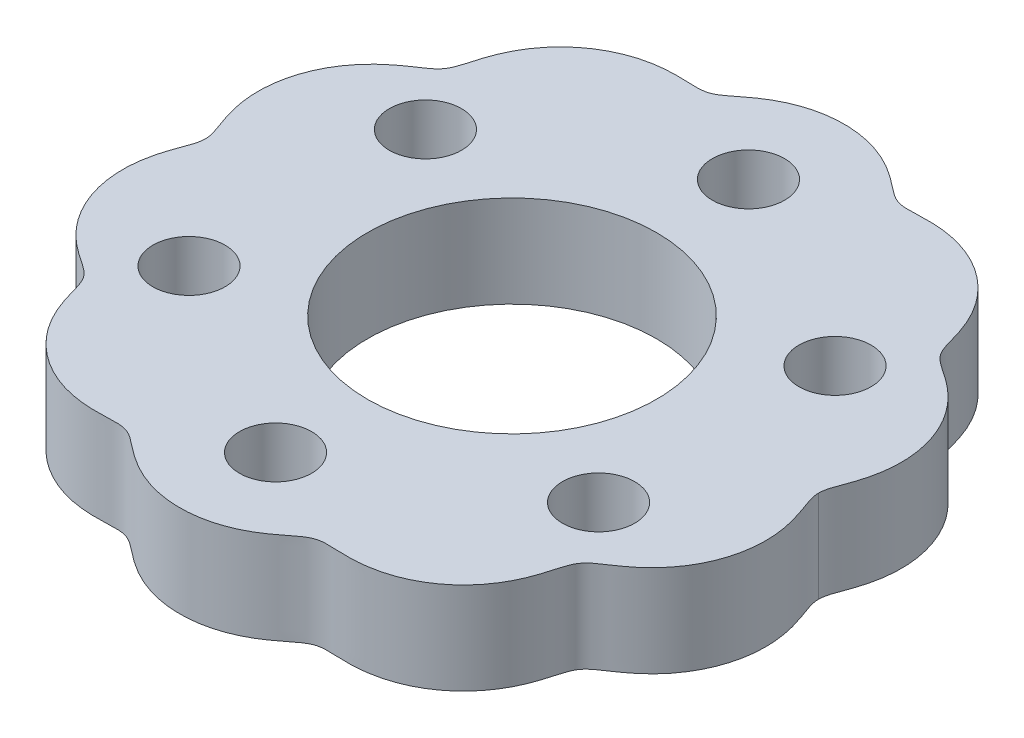
from build123d import *

# Parameters (mm, degrees)
SKETCH1_R           = 11
BOSS_EXTRUDE1_DEPTH = 7
SKETCH2_R           = 2.75
CUT_EXTRUDE1_DEPTH  = 36.882862426


with BuildPart() as part:
    # Sketch1 → Boss-Extrude1 (new body)
    with BuildSketch(Plane(origin=(0, 0, 0), x_dir=(1, 0, 0), z_dir=(0, 1, 0))):
        with BuildLine():
            add(Edge.make_bspline(
                [(23.34513946, 0), (23.34513946, -0.019841849), (23.345857024, -0.059526539), (23.349086064, -0.131972669), (23.357556048, -0.232630023), (23.372071983, -0.342829816), (23.394627325, -0.463844292), (23.42679411, -0.602083409), (23.469272032, -0.754115108), (23.518766494, -0.911207547), (23.574301258, -1.074038595), (23.650463686, -1.286648292), (23.747403521, -1.548939367), (23.859330357, -1.855388562), (24.010775252, -2.296239437), (24.172307839, -2.831938769), (24.322680796, -3.467630655), (24.43509115, -4.205703258), (24.49722378, -5.137006136), (24.443208092, -6.257490487), (24.192031764, -7.544978102), (23.655168641, -8.944366843), (22.885138777, -10.230698218), (21.904732121, -11.364217407), (20.940073548, -12.163449269), (20.10299199, -12.716798247), (19.493333172, -13.128038299), (19.136683847, -13.414056341), (18.845316969, -13.747591241), (18.659306345, -14.090946802), (18.532638856, -14.426757937), (18.408446796, -14.826850067), (18.228407959, -15.481027869), (17.948461455, -16.416013941), (17.439836685, -17.587775117), (16.620670211, -18.84294683), (15.596856575, -19.937990999), (14.399706124, -20.840021851), (13.064682854, -21.521820777), (11.811251526, -21.908028313), (10.703318085, -22.082620055), (9.786396812, -22.129613288), (9.155870124, -22.121246094), (8.626814751, -22.098225929), (8.218064234, -22.08526951), (7.915067374, -22.086238639), (7.605101517, -22.10879134), (7.285997765, -22.167002323), (6.846391649, -22.332062806), (6.360022198, -22.666279074), (5.833479317, -23.093709021), (5.223911343, -23.560790037), (4.604706463, -23.976916548), (3.792237954, -24.43634194), (2.760935396, -24.8773862), (1.493349134, -25.214815983), (1.7353e-05, -25.344645275), (-1.493389976, -25.214809826), (-2.760882247, -24.877400075), (-3.792312658, -24.43631799), (-4.604587047, -23.97695782), (-5.224160138, -23.560702949), (-5.75056756, -23.157070774), (-6.203310659, -22.793749052), (-6.560482534, -22.530303062), (-6.821899181, -22.368719533), (-7.089275116, -22.240696292), (-7.334721546, -22.158314502), (-7.605211336, -22.108620497), (-7.914993021, -22.086350017), (-8.218112322, -22.085198339), (-8.626785765, -22.098268724), (-9.155886973, -22.121221238), (-9.786388709, -22.12962524), (-10.703322745, -22.082613184), (-11.811248592, -21.90803264), (-13.06468466, -21.521818113), (-14.399705093, -20.840023372), (-15.596857207, -19.937990067), (-16.620669798, -18.84294744), (-17.439836994, -17.587774662), (-17.948461244, -16.416014251), (-18.228408078, -15.481027693), (-18.408446741, -14.826850149), (-18.532638885, -14.426757895), (-18.65930633, -14.090946825), (-18.845316978, -13.747591228), (-19.136683842, -13.414056349), (-19.493333175, -13.128038294), (-20.102991988, -12.71679825), (-20.94007355, -12.163449267), (-21.90473212, -11.364217408), (-22.885138778, -10.230698216), (-23.655168641, -8.944366843), (-24.192031764, -7.544978102), (-24.443208092, -6.257490486), (-24.49722378, -5.137006136), (-24.43509115, -4.205703258), (-24.322680796, -3.467630654), (-24.172307839, -2.831938769), (-24.010775253, -2.296239437), (-23.859330357, -1.855388561), (-23.747403521, -1.548939367), (-23.650463686, -1.286648292), (-23.574301258, -1.074038595), (-23.518766494, -0.911207546), (-23.469272032, -0.754115107), (-23.42679411, -0.602083408), (-23.394627325, -0.463844292), (-23.372071983, -0.342829816), (-23.357556048, -0.232630022), (-23.349086064, -0.131972669), (-23.345857024, -0.059526539), (-23.34513946, -0.019841849), (-23.34513946, 0)],
                knots=[0.07419089, 0.07419089, 0.07419089, 0.07419089, 0.07419089, 0.075181354, 0.076171818, 0.077162282, 0.078152746, 0.079827677, 0.081502608, 0.08317754, 0.084852471, 0.08683375, 0.088815028, 0.092777585, 0.096740142, 0.100702699, 0.108628816, 0.116554932, 0.12448019, 0.132405447, 0.148256714, 0.164108108, 0.179959356, 0.195810375, 0.211662134, 0.227513365, 0.23298372, 0.238454075, 0.242930785, 0.246890307, 0.251682833, 0.254933606, 0.258184379, 0.264685924, 0.280537042, 0.296388376, 0.31224015, 0.328091244, 0.34394255, 0.359793511, 0.37564531, 0.383570468, 0.391495626, 0.398790457, 0.402437872, 0.406085287, 0.408877289, 0.411669291, 0.415630359, 0.419842127, 0.428669278, 0.436594793, 0.444520309, 0.452445901, 0.460371494, 0.476222867, 0.492074291, 0.507925709, 0.523777133, 0.539628506, 0.547554099, 0.555479691, 0.563405207, 0.571330722, 0.575744298, 0.580157873, 0.582263757, 0.584369641, 0.588330709, 0.591122711, 0.593914713, 0.597562128, 0.601209543, 0.608504374, 0.616429532, 0.62435469, 0.640206489, 0.65605745, 0.671908756, 0.68775985, 0.703611624, 0.719462958, 0.735314076, 0.741815621, 0.745066394, 0.748317167, 0.753109693, 0.757069215, 0.761545925, 0.76701628, 0.772486635, 0.788337866, 0.804189625, 0.820040644, 0.835891892, 0.851743286, 0.867594553, 0.87551981, 0.883445068, 0.891371184, 0.899297301, 0.903259858, 0.907222415, 0.911184972, 0.91316625, 0.915147529, 0.91682246, 0.918497392, 0.920172323, 0.921847254, 0.922837718, 0.923828182, 0.924818646, 0.92580911, 0.92580911, 0.92580911, 0.92580911, 0.92580911], degree=4))
            add(Edge.make_bspline(
                [(23.34513946, 0), (23.34513946, 0.019841849), (23.345857024, 0.059526539), (23.349086064, 0.131972669), (23.357556048, 0.232630023), (23.372071983, 0.342829816), (23.394627325, 0.463844292), (23.42679411, 0.602083408), (23.469272032, 0.754115108), (23.518766494, 0.911207546), (23.574301258, 1.074038595), (23.650463686, 1.286648292), (23.747403521, 1.548939367), (23.859330357, 1.855388562), (24.010775252, 2.296239437), (24.172307839, 2.831938769), (24.322680796, 3.467630654), (24.43509115, 4.205703258), (24.49722378, 5.137006136), (24.443208092, 6.257490486), (24.192031764, 7.544978102), (23.655168641, 8.944366843), (22.885138777, 10.230698217), (21.904732121, 11.364217407), (20.940073549, 12.163449269), (20.10299199, 12.716798247), (19.493333172, 13.128038299), (19.136683847, 13.414056341), (18.845316969, 13.747591241), (18.659306345, 14.090946802), (18.532638856, 14.426757937), (18.408446796, 14.826850067), (18.228407959, 15.481027868), (17.948461455, 16.416013941), (17.439836685, 17.587775117), (16.620670211, 18.84294683), (15.596856575, 19.937990998), (14.399706124, 20.84002185), (13.064682854, 21.521820776), (11.811251526, 21.908028312), (10.703318085, 22.082620055), (9.786396812, 22.129613288), (9.155870124, 22.121246094), (8.626814751, 22.098225929), (8.218064234, 22.08526951), (7.915067374, 22.086238639), (7.605101517, 22.10879134), (7.285997765, 22.167002323), (6.846391649, 22.332062806), (6.360022198, 22.666279074), (5.833479317, 23.093709021), (5.223911343, 23.560790037), (4.604706464, 23.976916548), (3.792237954, 24.43634194), (2.760935396, 24.8773862), (1.493349134, 25.214815983), (1.7353e-05, 25.344645274), (-1.493389976, 25.214809826), (-2.760882247, 24.877400075), (-3.792312658, 24.43631799), (-4.604587047, 23.97695782), (-5.224160137, 23.560702949), (-5.75056756, 23.157070774), (-6.203310659, 22.793749052), (-6.560482534, 22.530303062), (-6.821899181, 22.368719533), (-7.089275116, 22.240696292), (-7.334721546, 22.158314501), (-7.605211336, 22.108620497), (-7.914993021, 22.086350017), (-8.218112322, 22.085198339), (-8.626785764, 22.098268724), (-9.155886973, 22.121221238), (-9.786388709, 22.12962524), (-10.703322745, 22.082613184), (-11.811248592, 21.90803264), (-13.06468466, 21.521818113), (-14.399705092, 20.840023372), (-15.596857206, 19.937990067), (-16.620669798, 18.84294744), (-17.439836994, 17.587774663), (-17.948461244, 16.416014251), (-18.228408078, 15.481027693), (-18.408446741, 14.826850149), (-18.532638884, 14.426757895), (-18.65930633, 14.090946825), (-18.845316978, 13.747591228), (-19.136683842, 13.414056349), (-19.493333175, 13.128038294), (-20.102991988, 12.71679825), (-20.94007355, 12.163449267), (-21.90473212, 11.364217408), (-22.885138778, 10.230698217), (-23.655168641, 8.944366843), (-24.192031764, 7.544978102), (-24.443208092, 6.257490486), (-24.49722378, 5.137006136), (-24.43509115, 4.205703258), (-24.322680796, 3.467630654), (-24.172307839, 2.831938769), (-24.010775253, 2.296239437), (-23.859330357, 1.855388561), (-23.747403521, 1.548939367), (-23.650463686, 1.286648292), (-23.574301258, 1.074038595), (-23.518766494, 0.911207546), (-23.469272032, 0.754115107), (-23.42679411, 0.602083408), (-23.394627325, 0.463844292), (-23.372071983, 0.342829816), (-23.357556048, 0.232630022), (-23.349086064, 0.131972669), (-23.345857024, 0.059526539), (-23.34513946, 0.019841849), (-23.34513946, 0)],
                knots=[0.07419089, 0.07419089, 0.07419089, 0.07419089, 0.07419089, 0.075181354, 0.076171818, 0.077162282, 0.078152746, 0.079827677, 0.081502608, 0.08317754, 0.084852471, 0.08683375, 0.088815028, 0.092777585, 0.096740142, 0.100702699, 0.108628816, 0.116554932, 0.12448019, 0.132405447, 0.148256714, 0.164108108, 0.179959356, 0.195810375, 0.211662134, 0.227513365, 0.23298372, 0.238454075, 0.242930785, 0.246890307, 0.251682833, 0.254933606, 0.258184379, 0.264685924, 0.280537042, 0.296388376, 0.31224015, 0.328091244, 0.34394255, 0.359793511, 0.37564531, 0.383570468, 0.391495626, 0.398790457, 0.402437872, 0.406085287, 0.408877289, 0.411669291, 0.415630359, 0.419842127, 0.428669278, 0.436594793, 0.444520309, 0.452445901, 0.460371494, 0.476222867, 0.492074291, 0.507925709, 0.523777133, 0.539628506, 0.547554099, 0.555479691, 0.563405207, 0.571330722, 0.575744298, 0.580157873, 0.582263757, 0.584369641, 0.588330709, 0.591122711, 0.593914713, 0.597562128, 0.601209543, 0.608504374, 0.616429532, 0.62435469, 0.640206489, 0.65605745, 0.671908756, 0.68775985, 0.703611624, 0.719462958, 0.735314076, 0.741815621, 0.745066394, 0.748317167, 0.753109693, 0.757069215, 0.761545925, 0.76701628, 0.772486635, 0.788337866, 0.804189625, 0.820040644, 0.835891892, 0.851743286, 0.867594553, 0.87551981, 0.883445068, 0.891371184, 0.899297301, 0.903259858, 0.907222415, 0.911184972, 0.91316625, 0.915147529, 0.91682246, 0.918497392, 0.920172323, 0.921847254, 0.922837718, 0.923828182, 0.924818646, 0.92580911, 0.92580911, 0.92580911, 0.92580911, 0.92580911], degree=4))
        make_face()
        with Locations(Location((0, 0, 0), (0, 0, 270))):
            Circle(SKETCH1_R, mode=Mode.SUBTRACT)
    extrude(amount=BOSS_EXTRUDE1_DEPTH)

    # Sketch2 → Cut-Extrude1 (cut, through all)
    with BuildSketch(Plane(origin=(0, 7, 0), x_dir=(1, 0, 0), z_dir=(0, 1, 0))):
        with Locations(Location((0, 18, 0), (0, 0, 270))):
            Circle(SKETCH2_R)
        with Locations(Location((15.588457268, 9, 0), (0, 0, 270))):
            Circle(SKETCH2_R)
        with Locations(Location((15.588457268, -9, 0), (0, 0, 270))):
            Circle(SKETCH2_R)
        with Locations(Location((0, -18, 0), (0, 0, 270))):
            Circle(SKETCH2_R)
        with Locations(Location((-15.588457268, -9, 0), (0, 0, 270))):
            Circle(SKETCH2_R)
        with Locations(Location((-15.588457268, 9, 0), (0, 0, 270))):
            Circle(SKETCH2_R)
    extrude(amount=-CUT_EXTRUDE1_DEPTH, mode=Mode.SUBTRACT)


solid = part.part
